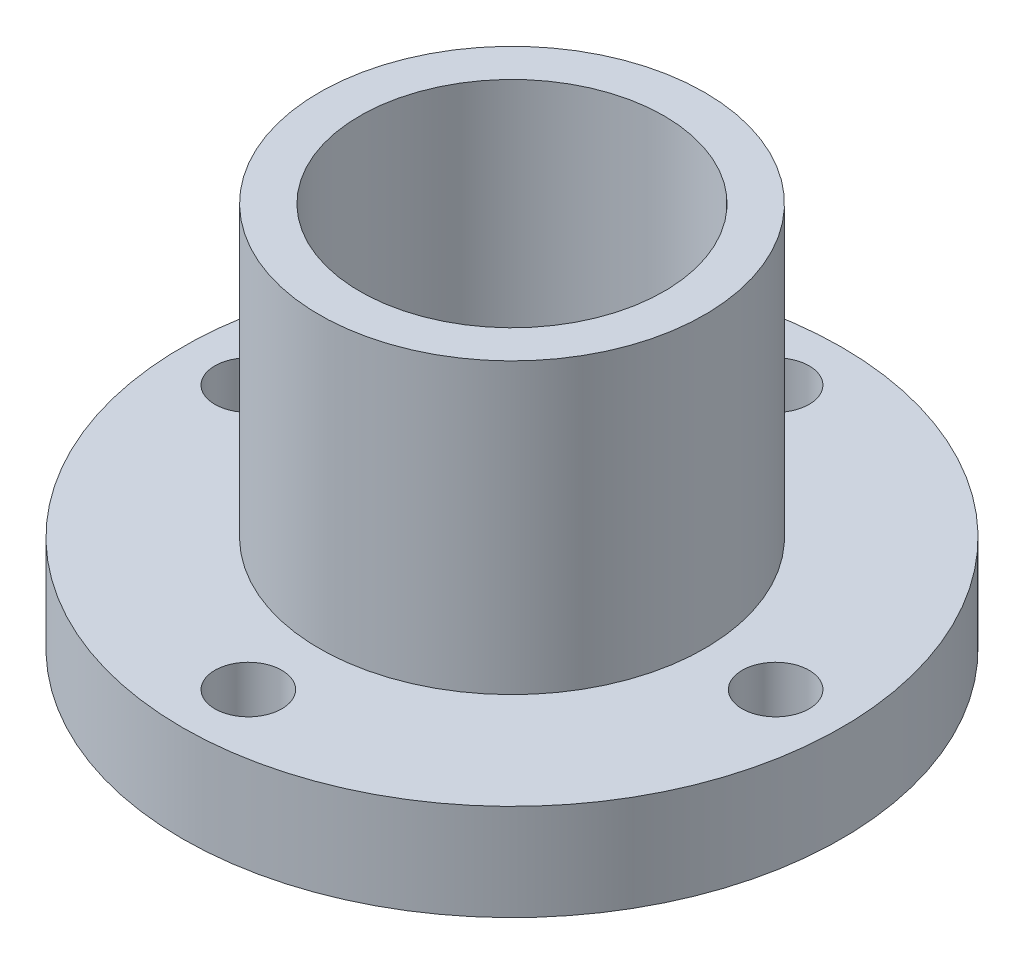
from build123d import *

# Parameters (mm, degrees)
F_6_6_6_6_DIAMETER_HOLE1_D = 6.6


with BuildPart() as part:
    # Sketch1 → Revolve1 (revolve)
    with BuildSketch(Plane.XY):
        Polygon((15, 38), (15, 0), (32.5, 0), (32.5, 9.5), (19, 9.5), (19, 38), align=None)
    revolve(axis=Axis((0, 0, 0), (0, 1, 0)))

    # Ø6.6 (6.6) Diameter Hole1 (through all)
    with Locations(Plane(origin=(0, 9.5, 0), x_dir=(1, 0, 0), z_dir=(0, 1, 0))):
        with Locations((0, 26), (0, -26), (26, 0), (-26, 0)):
            Hole(F_6_6_6_6_DIAMETER_HOLE1_D / 2)


solid = part.part
